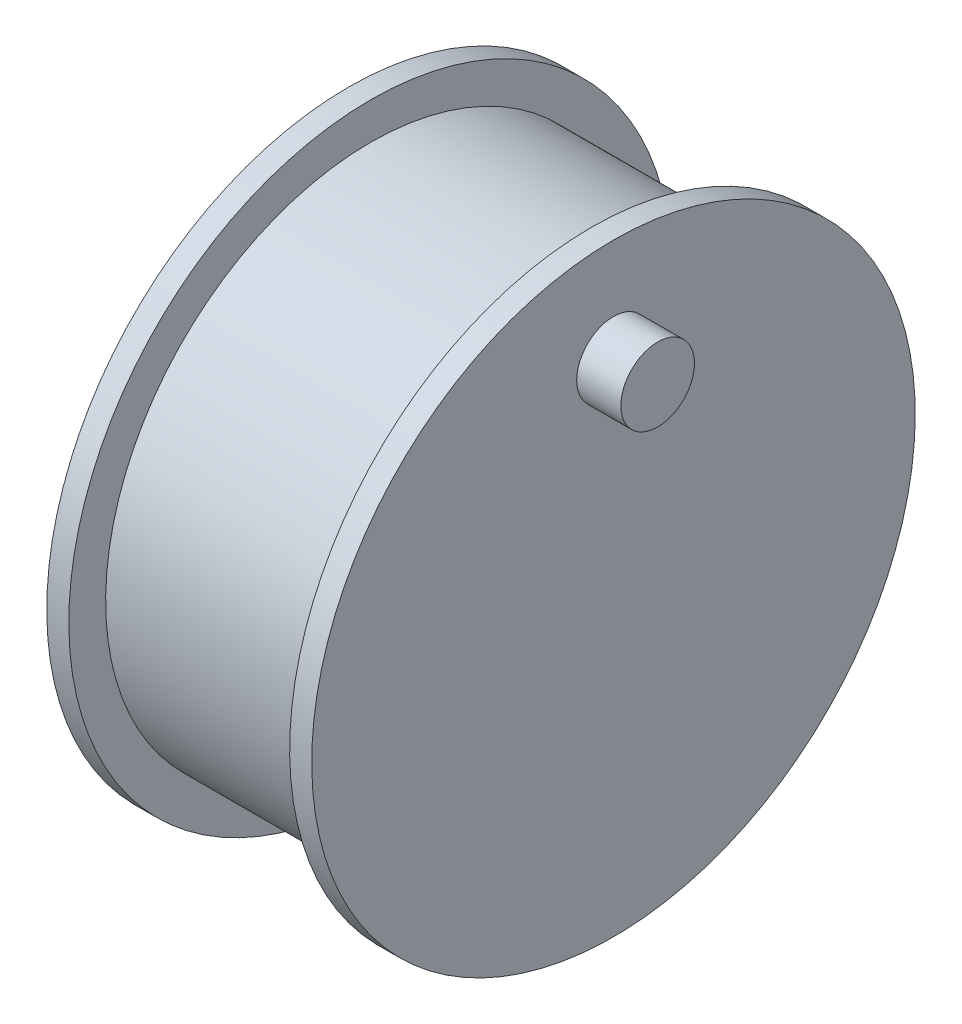
from build123d import *

# Parameters (mm, degrees)
SKETCH2_R           = 2.5
BOSS_EXTRUDE1_DEPTH = 3


with BuildPart() as part:
    # Sketch1 → Revolve1 (revolve)
    with BuildSketch(Plane.XY):
        Polygon((9, 0), (-9, 0), (-9, 20.5), (-7.5, 20.5), (-7.5, 18), (7.5, 18), (7.5, 20.5), (9, 20.5), align=None)
    revolve(axis=Axis((9, 0, 0), (-1, 0, 0)))

    # Sketch2 → Boss-Extrude1 (add)
    with BuildSketch(Plane(origin=(9, 0, 0), x_dir=(0, 0, -1), z_dir=(1, 0, 0))):
        with Locations(Location((0, 13.5, 0), (0, 0, 90))):
            Circle(SKETCH2_R)
    extrude(amount=BOSS_EXTRUDE1_DEPTH)


solid = part.part
